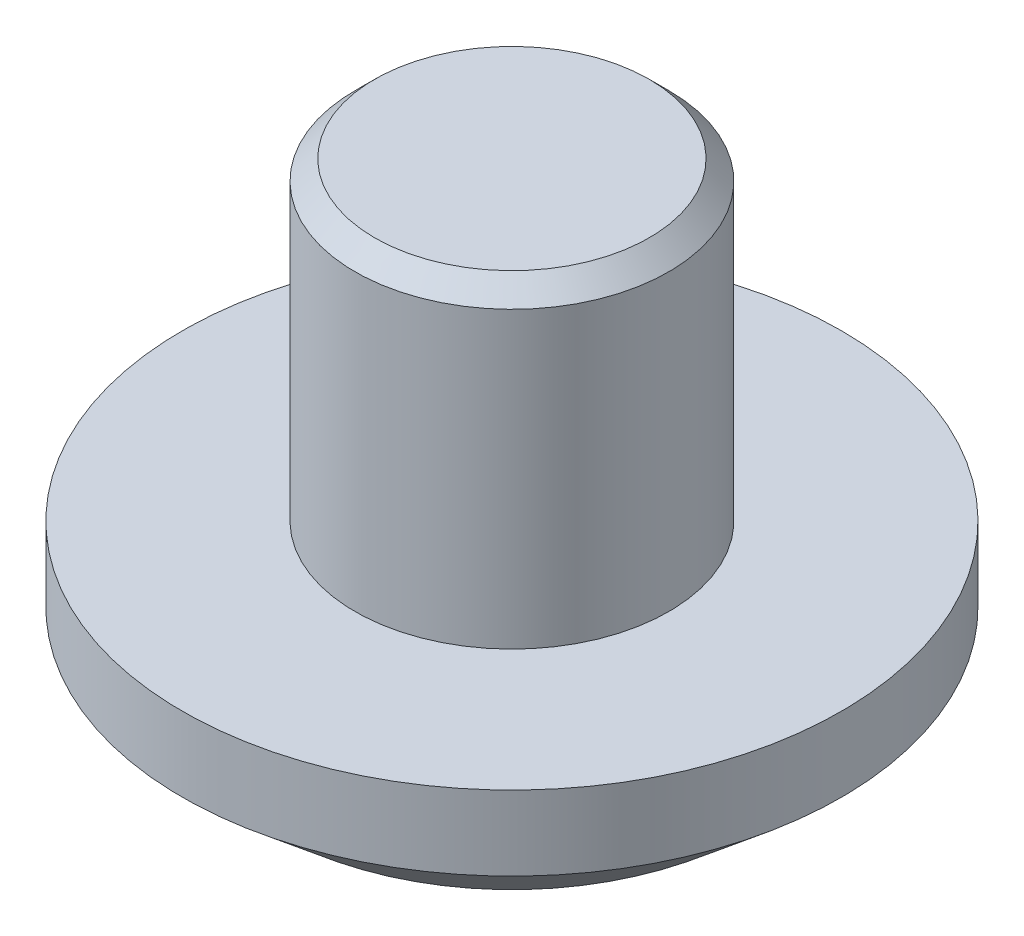
from build123d import *

# Parameters (mm, degrees)
CUT_EXTRUDE_1_REACH = 10.372


with BuildPart() as part:
    # 草图1 → 旋转1 (revolve)
    with BuildSketch(Plane.XY, mode=Mode.PRIVATE) as revolve_1_sk:
        Polygon((2, 0), (2, 3.75), (1.75, 4), (0, 4), (0, 0), (1.25, -0.751075774), (1.25, -1.9), (3.067834087, -1.9), (4.2, -0.95), (4.2, 0), align=None)
    revolve(revolve_1_sk.sketch.rotate(Axis((0, 0, 0), (0, 1, 0)), 90), axis=Axis((0, 0, 0), (0, 1, 0)))

    # 切除-拉伸1: up to this cone (the profile starts inside it)
    cut_extrude_1_end = Plane(origin=(0, -1.9, 0), z_dir=(0, -1, 0)).offset(-1.899999) * Cone(1.664e-06, 26.51884732, 15.934130016, align=(Align.CENTER, Align.CENTER, Align.MIN), mode=Mode.PRIVATE)
    # 草图2 → 切除-拉伸1 (cut, up to the surface)
    with BuildSketch(Plane.XZ.offset(1.9), mode=Mode.PRIVATE) as cut_extrude_1_sk1:
        Polygon((1.443375673, 0), (0.721687836, 1.25), (-0.721687836, 1.25), (-1.443375673, 0), (-0.721687836, -1.25), (0.721687836, -1.25), align=None)
    cut_extrude_1_tool1 = extrude(cut_extrude_1_sk1.sketch, amount=-CUT_EXTRUDE_1_REACH, mode=Mode.PRIVATE) & cut_extrude_1_end
    add(cut_extrude_1_tool1.solids().sort_by_distance((0, -1.9, 0))[0], mode=Mode.SUBTRACT)


solid = part.part
